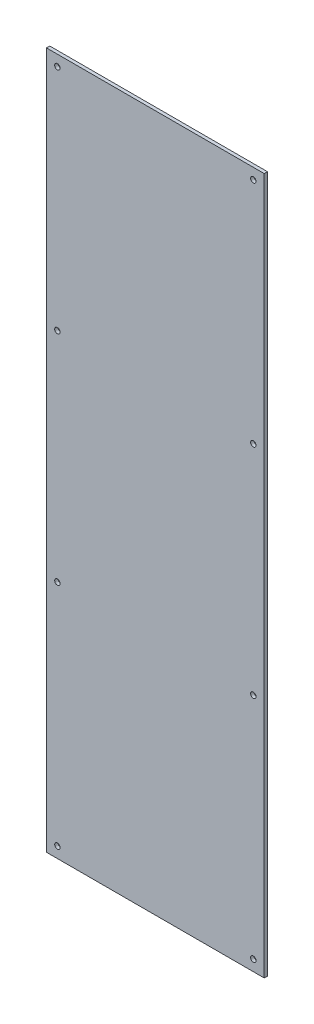
from build123d import *

# Parameters (mm, degrees)
SKETCH2_W           = 200
SKETCH2_H           = 640
BOSS_EXTRUDE1_DEPTH = 3
SKETCH3_R           = 2.5
CUT_EXTRUDE1_DEPTH  = 586.141929558


with BuildPart() as part:
    # Sketch2 → Boss-Extrude1 (new body)
    with BuildSketch(Plane.XY):
        with Locations((72.892561983, -239.008264463)):
            Rectangle(SKETCH2_W, SKETCH2_H)
    extrude(amount=BOSS_EXTRUDE1_DEPTH)

    # Sketch3 → Cut-Extrude1 (cut, through all)
    with BuildSketch(Plane.XY.offset(3)):
        with Locations((162.892561983, -549.008264463)):
            Circle(SKETCH3_R)
        with Locations((-17.107438017, -549.008264463)):
            Circle(SKETCH3_R)
        with Locations((-17.107438017, -339.008264463)):
            Circle(SKETCH3_R)
        with Locations((-17.107438017, 70.991735537)):
            Circle(SKETCH3_R)
        with Locations((-17.107438017, -139.008264463)):
            Circle(SKETCH3_R)
        with Locations((162.892561983, 70.991735537)):
            Circle(SKETCH3_R)
        with Locations((162.892561983, -139.008264463)):
            Circle(SKETCH3_R)
        with Locations((162.892561983, -339.008264463)):
            Circle(SKETCH3_R)
    extrude(amount=-CUT_EXTRUDE1_DEPTH, mode=Mode.SUBTRACT)


solid = part.part
